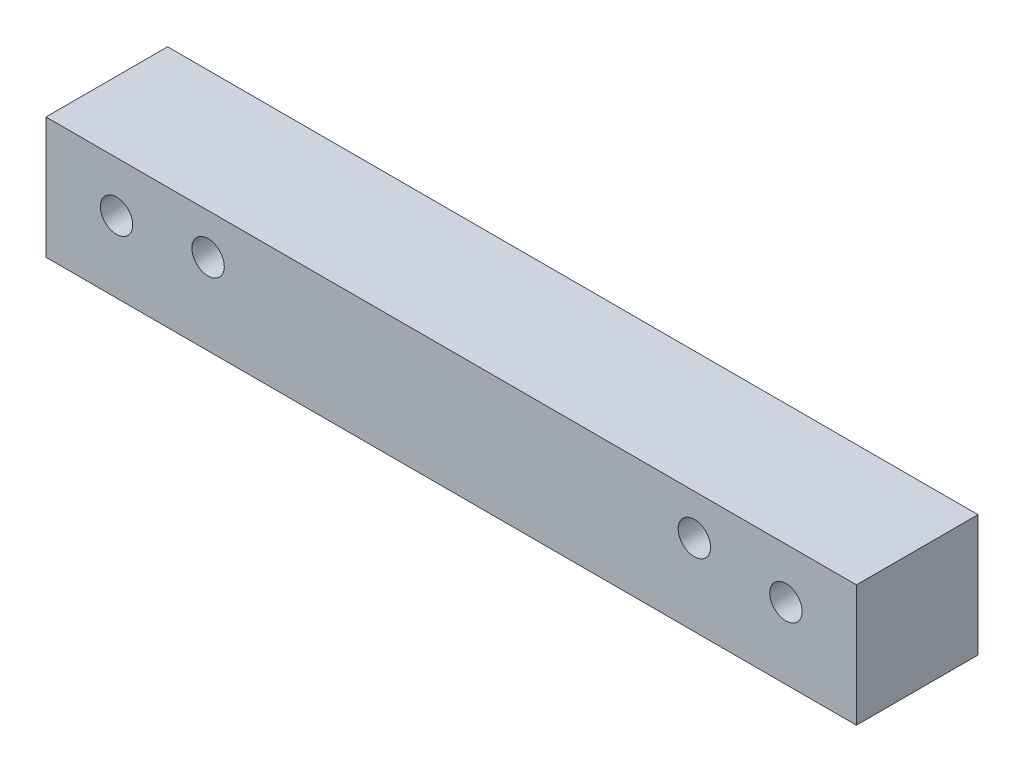
from build123d import *

# Parameters (mm, degrees)
SKETCH1_W           = 127
SKETCH1_H           = 19.05
BOSS_EXTRUDE1_DEPTH = 19.05
CUT_EXTRUDE1_REACH  = 111.559
SKETCH2_R           = 2.54
CUT_EXTRUDE2_REACH  = 111.559
SKETCH3_R           = 2.54


with BuildPart() as part:
    # Sketch1 → Boss-Extrude1 (new body)
    with BuildSketch(Plane(origin=(0, 0, 0), x_dir=(1, 0, 0), z_dir=(0, 1, 0))):
        with Locations((-42.694499973, -2.843794964)):
            Rectangle(SKETCH1_W, SKETCH1_H)
    extrude(amount=BOSS_EXTRUDE1_DEPTH)

    # Sketch2 → Cut-Extrude1 (cut, up to next)
    with BuildSketch(Plane.XY.offset(12.368794964), mode=Mode.PRIVATE) as cut_extrude1_sk1:
        with Locations((-4.594499973, 12.7)):
            Circle(SKETCH2_R)
    cut_extrude1_tool1 = extrude(cut_extrude1_sk1.sketch, amount=-CUT_EXTRUDE1_REACH, mode=Mode.PRIVATE) & part.part
    # Sketch2 → Cut-Extrude1 (cut, up to next)
    with BuildSketch(Plane.XY.offset(12.368794964), mode=Mode.PRIVATE) as cut_extrude1_sk2:
        with Locations((-80.794499973, 12.7)):
            Circle(SKETCH2_R)
    cut_extrude1_tool2 = extrude(cut_extrude1_sk2.sketch, amount=-CUT_EXTRUDE1_REACH, mode=Mode.PRIVATE) & part.part
    add(cut_extrude1_tool1.solids().sort_by_distance((-4.5945, 12.7, 12.368795))[0], mode=Mode.SUBTRACT)
    add(cut_extrude1_tool2.solids().sort_by_distance((-80.7945, 12.7, 12.368795))[0], mode=Mode.SUBTRACT)

    # Sketch3 → Cut-Extrude2 (cut, up to next)
    with BuildSketch(Plane(origin=(0, 0, -6.681205036), x_dir=(-1, 0, 0), z_dir=(0, 0, -1)), mode=Mode.PRIVATE) as cut_extrude2_sk1:
        with Locations((95.145499973, 11.176)):
            Circle(SKETCH3_R)
    cut_extrude2_tool1 = extrude(cut_extrude2_sk1.sketch, amount=-CUT_EXTRUDE2_REACH, mode=Mode.PRIVATE) & part.part
    # Sketch3 → Cut-Extrude2 (cut, up to next)
    with BuildSketch(Plane(origin=(0, 0, -6.681205036), x_dir=(-1, 0, 0), z_dir=(0, 0, -1)), mode=Mode.PRIVATE) as cut_extrude2_sk2:
        with Locations((-9.756500027, 11.176)):
            Circle(SKETCH3_R)
    cut_extrude2_tool2 = extrude(cut_extrude2_sk2.sketch, amount=-CUT_EXTRUDE2_REACH, mode=Mode.PRIVATE) & part.part
    add(cut_extrude2_tool1.solids().sort_by_distance((-95.1455, 11.176, -6.681205))[0], mode=Mode.SUBTRACT)
    add(cut_extrude2_tool2.solids().sort_by_distance((9.7565, 11.176, -6.681205))[0], mode=Mode.SUBTRACT)


solid = part.part
